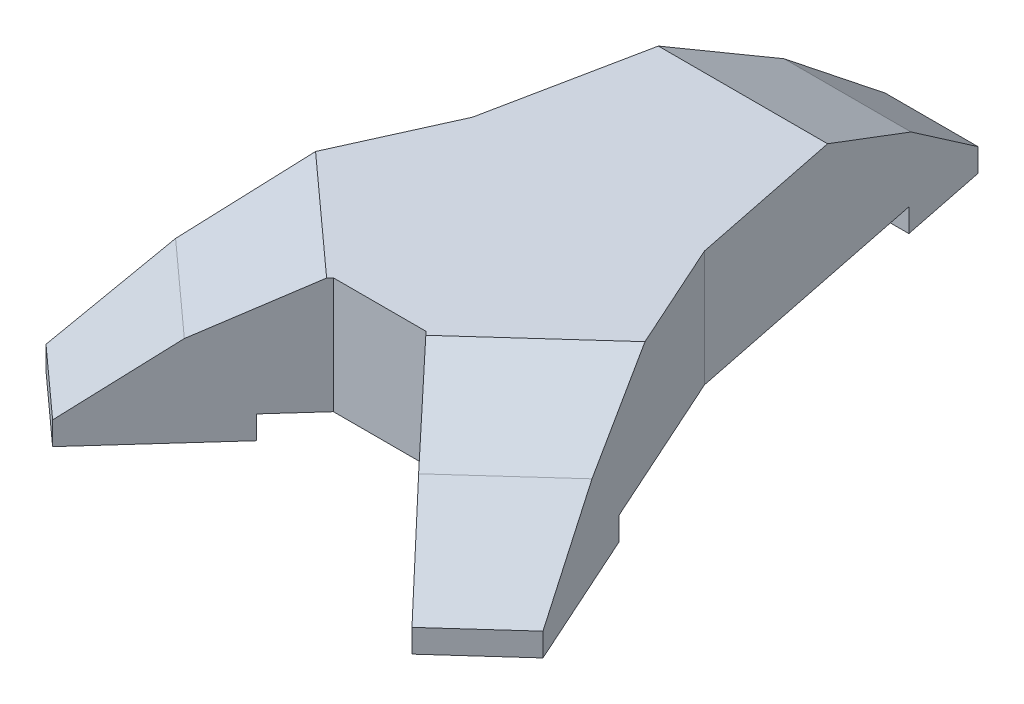
from build123d import *

# Parameters (mm, degrees)
BOSS_EXTRUDE1_DEPTH = 6.35
BOSS_EXTRUDE2_REACH = 146.797
BOSS_EXTRUDE4_REACH = 127.921
BOSS_EXTRUDE5_DEPTH = 31.75
SKETCH6_W           = 35.398432863
SKETCH6_H           = 63.441579166
CUT_EXTRUDE3_DEPTH  = 124.542305817
CUT_EXTRUDE2_DEPTH  = 6.35


with BuildPart() as part:
    # Sketch1 → Boss-Extrude1 (new body)
    with BuildSketch(Plane(origin=(0, 0, 0), x_dir=(1, 0, 0), z_dir=(0, 1, 0))):
        Polygon((0, 95.814735378), (-12.7, 95.814735378), (-31.75, 1.834735378), (-68.048716454, -78.671924952), (-49.205184033, -95.703697788), (-12.7, -55.315264622), (0, -55.315264622), align=None)
    extrude(amount=BOSS_EXTRUDE1_DEPTH)

    # Boss-Extrude2: up to this plane
    boss_extrude2_end = Plane(origin=(-31.75, 6.35, -1.834735378), z_dir=(0.9116215886149588, 0, 0.4110305088082135))
    # Sketch3 → Boss-Extrude2 (add, up to the surface)
    with BuildSketch(Plane(origin=(20.527176154, 0, 18.553538338), x_dir=(0.6705422376066268, 0, -0.7418713551455524), z_dir=(0.7418713551455524, 0, 0.6705422376066268)), mode=Mode.PRIVATE) as boss_extrude2_sk1:
        Polygon((-103.993986173, 6.35), (-78.453176795, 24.733648606), (-50.864728594, 38.1), (9.629554025, 38.1), (9.629554025, 6.35), align=None)
    boss_extrude2_tool1 = split(extrude(boss_extrude2_sk1.sketch, amount=-BOSS_EXTRUDE2_REACH, mode=Mode.PRIVATE), bisect_by=boss_extrude2_end, keep=Keep.BOTH, mode=Mode.PRIVATE)
    add(boss_extrude2_tool1.solids().sort_by_distance((-3.940159, 20.681693, 45.623593))[0])

    # Boss-Extrude4: up to this plane
    boss_extrude4_end = Plane(origin=(-12.7, 6.35, -95.814735378), z_dir=(0.9800679771232679, 0, 0.19866242779525697))
    # Sketch4 → Boss-Extrude4 (add, up to the surface)
    with BuildSketch(Plane(origin=(0, 0, -3.158589171), x_dir=(0, 0, 1), z_dir=(-1, 0, 0)), mode=Mode.PRIVATE) as boss_extrude4_sk1:
        Polygon((-92.656146207, 6.35), (1.323853793, 6.35), (1.323853793, 38.1), (-40.992152204, 38.1), (-69.631684908, 23.673473414), align=None)
    boss_extrude4_tool1 = split(extrude(boss_extrude4_sk1.sketch, amount=BOSS_EXTRUDE4_REACH, mode=Mode.PRIVATE), bisect_by=boss_extrude4_end, keep=Keep.BOTH, mode=Mode.PRIVATE)
    add(boss_extrude4_tool1.solids().sort_by_distance((0, 20.310013, -38.759281))[0])

    # Sketch5 → Boss-Extrude5 (add)
    with BuildSketch(Plane(origin=(0, 6.35, 0), x_dir=(1, 0, 0), z_dir=(0, 1, 0))):
        Polygon((0, -41.26429858), (0, -55.315264622), (-12.7, -55.315264622), align=None)
    extrude(amount=BOSS_EXTRUDE5_DEPTH)

    # Sketch6 → Cut-Extrude3 (cut, through all)
    with BuildSketch(Plane(origin=(0, 38.1, 0), x_dir=(1, 0, 0), z_dir=(0, 1, 0))):
        with Locations((17.699216432, -13.706659905)):
            Rectangle(SKETCH6_W, SKETCH6_H)
    extrude(amount=-CUT_EXTRUDE3_DEPTH, mode=Mode.SUBTRACT)

    # Sketch7 → Cut-Extrude2 (cut)
    with BuildSketch(Plane.XZ):
        Polygon((-22.7010489, 66.380177888), (-50.981549283, 40.818778494), (-31.75, -1.834735378), (-17.513793047, -72.066689682), (0, -72.066689682), (0, 55.315264622), (-12.7, 55.315264622), align=None)
    extrude(amount=-CUT_EXTRUDE2_DEPTH, mode=Mode.SUBTRACT)

    # Mirror2: part across plane


with BuildPart() as part_1:
    add(part.part)
    add(part.part.mirror(Plane(origin=(0, 0, 0), x_dir=(0, 0, 1), z_dir=(1, 0, 0))))


solid = part_1.part
